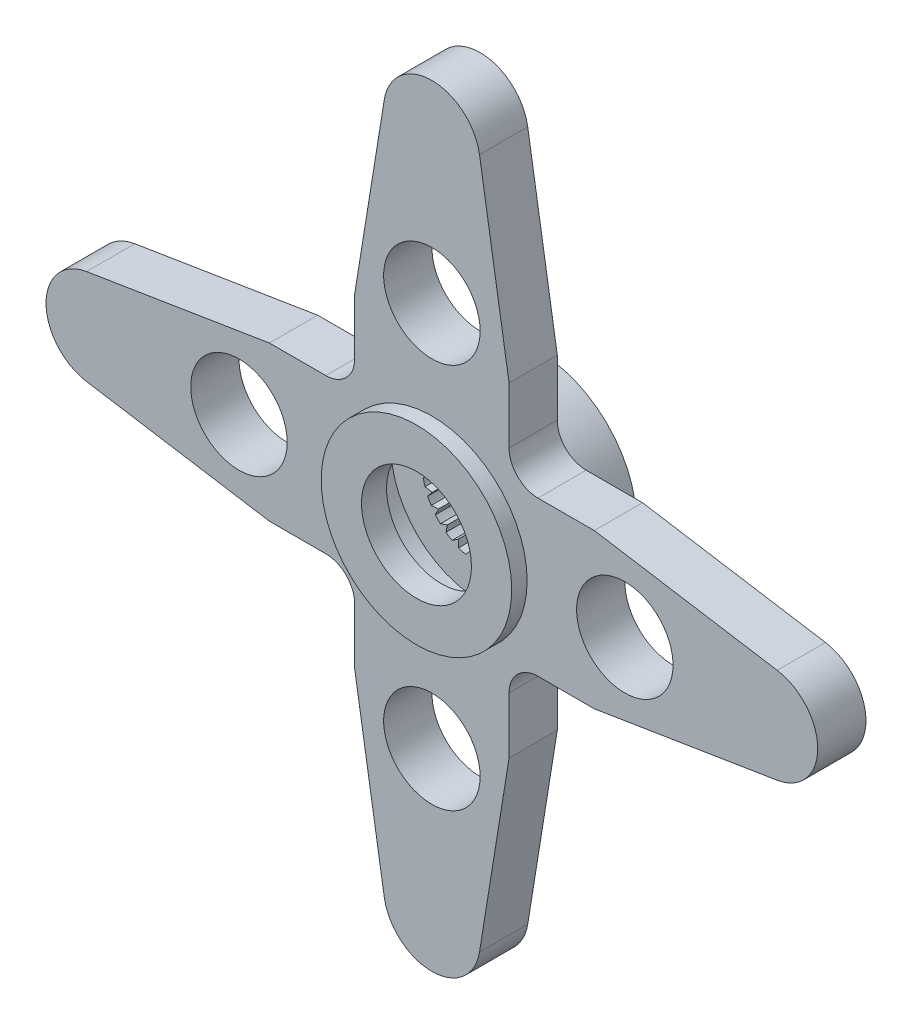
from build123d import *

# Parameters (mm, degrees)
BOSS_EXTRUDE1_DEPTH  = 2.5
M8_CLEARANCE_HOLE1_D = 9.25
SKETCH4_R            = 4.937986177
BOSS_EXTRUDE2_DEPTH  = 1.3
SKETCH5_R            = 5.099596851
BOSS_EXTRUDE3_DEPTH  = 3
CUT_EXTRUDE1_DEPTH   = 3.6
FILLET1_R            = 1.5
SKETCH11_R           = 2.5
CUT_EXTRUDE2_DEPTH   = 10


with BuildPart() as part:
    # Sketch1 → Boss-Extrude1 (new body)
    with BuildSketch(Plane.XY.offset(2.5)):
        with BuildLine():
            Line((4, -8.419183588), (4, -4))
            Line((4, -4), (8.419183588, -4))
            Line((8.419183588, -4), (17.898853189, -2.467978147))
            ThreePointArc((17.898853189, -2.467978147), (20, 0), (17.898853189, 2.467978147))
            Line((17.898853189, 2.467978147), (8.419183588, 4))
            Line((8.419183588, 4), (4, 4))
            Line((4, 4), (4, 8.419183588))
            Line((4, 8.419183588), (2.467978147, 17.898853189))
            ThreePointArc((2.467978147, 17.898853189), (0, 20), (-2.467978147, 17.898853189))
            Line((-2.467978147, 17.898853189), (-4, 8.419183588))
            Line((-4, 8.419183588), (-4, 4))
            Line((-4, 4), (-8.419183588, 4))
            Line((-8.419183588, 4), (-17.898853189, 2.467978147))
            ThreePointArc((-17.898853189, 2.467978147), (-20, 0), (-17.898853189, -2.467978147))
            Line((-17.898853189, -2.467978147), (-8.419183588, -4))
            Line((-8.419183588, -4), (-4, -4))
            Line((-4, -4), (-4, -8.419183588))
            Line((-4, -8.419183588), (-2.467978147, -17.898853189))
            ThreePointArc((-2.467978147, -17.898853189), (0, -20), (2.467978147, -17.898853189))
            Line((2.467978147, -17.898853189), (4, -8.419183588))
        make_face()
    extrude(amount=-BOSS_EXTRUDE1_DEPTH)

    # M8 Clearance Hole1 (through all)
    with Locations(Plane.XY.offset(2.5)):
        with Locations((0, 0)):
            Hole(M8_CLEARANCE_HOLE1_D / 2)

    # Sketch4 → Boss-Extrude2 (add)
    with BuildSketch(Plane(origin=(0, 0, 2), x_dir=(-1, 0, 0), z_dir=(0, 0, -1))):
        with Locations(Location((0, 0, 0), (0, 0, 180))):
            Circle(SKETCH4_R)
    extrude(amount=-BOSS_EXTRUDE2_DEPTH)

    # Sketch5 → Boss-Extrude3 (add)
    with BuildSketch(Plane.XY):
        with Locations(Location((0, 0, 0), (0, 0, 180))):
            Circle(SKETCH5_R)
    extrude(amount=-BOSS_EXTRUDE3_DEPTH)

    # Sketch6 → Cut-Extrude1 (cut)
    with BuildSketch(Plane(origin=(0, 0, -3), x_dir=(-1, 0, 0), z_dir=(0, 0, -1))):
        with BuildLine():
            Line((-2.994554723, 0.180671), (-2.667483, 0))
            Line((-2.667483, 0), (-2.993563417, -0.196413))
            ThreePointArc((-2.993563417, -0.196413), (-2.975345367, -0.383822804), (-2.94540633, -0.569720588))
            Line((-2.94540633, -0.569720588), (-2.583679116, -0.663376046))
            Line((-2.583679116, -0.663376046), (-2.850669191, -0.934711273))
            ThreePointArc((-2.850669191, -0.934711273), (-2.786416572, -1.111702609), (-2.711187226, -1.284314536))
            Line((-2.711187226, -1.284314536), (-2.337533172, -1.285069736))
            Line((-2.337533172, -1.285069736), (-2.528656935, -1.614278199))
            ThreePointArc((-2.528656935, -1.614278199), (-2.422406975, -1.76973005), (-2.306614256, -1.918210278))
            Line((-2.306614256, -1.918210278), (-1.944511421, -1.826017768))
            Line((-1.944511421, -1.826017768), (-2.047759865, -2.192414089))
            ThreePointArc((-2.047759865, -2.192414089), (-1.906188639, -2.316558843), (-1.75710823, -2.431577814))
            Line((-1.75710823, -2.431577814), (-1.429308867, -2.252230388))
            Line((-1.429308867, -2.252230388), (-1.438194511, -2.632792538))
            ThreePointArc((-1.438194511, -2.632792538), (-1.27019746, -2.717829725), (-1.097196632, -2.792160373))
            Line((-1.097196632, -2.792160373), (-0.824297579, -2.536927089))
            Line((-0.824297579, -2.536927089), (-0.738262106, -2.90774295))
            ThreePointArc((-0.738262106, -2.90774295), (-0.554395104, -2.948329369), (-0.368344134, -2.977301227))
            Line((-0.368344134, -2.977301227), (-0.167492643, -2.662219332))
            Line((-0.167492643, -2.662219332), (0.008058022, -2.999989178))
            ThreePointArc((0.008058022, -2.999989178), (0.196241936, -2.993574636), (0.383652781, -2.975367296))
            Line((0.383652781, -2.975367296), (0.499836471, -2.620234542))
            Line((0.499836471, -2.620234542), (0.753871834, -2.903735053))
            ThreePointArc((0.753871834, -2.903735053), (0.934548373, -2.850722599), (1.11154338, -2.786480094))
            Line((1.11154338, -2.786480094), (1.135759022, -2.41361078))
            Line((1.135759022, -2.41361078), (1.452317107, -2.625028575))
            ThreePointArc((1.452317107, -2.625028575), (1.614133699, -2.528749177), (1.769591621, -2.4225081))
            Line((1.769591621, -2.4225081), (1.700317656, -2.055330976))
            Line((1.700317656, -2.055330976), (2.059507955, -2.181381898))
            ThreePointArc((2.059507955, -2.181381898), (2.192297068, -2.047885144), (2.316449912, -1.906321013))
            Line((2.316449912, -1.906321013), (2.158039079, -1.567907168))
            Line((2.158039079, -1.567907168), (2.537292343, -1.600670974))
            ThreePointArc((2.537292343, -1.600670974), (2.63271035, -1.438344956), (2.717757136, -1.270352765))
            Line((2.717757136, -1.270352765), (2.48016297, -0.981965986))
            Line((2.48016297, -0.981965986), (2.855649322, -0.919384005))
            ThreePointArc((2.855649322, -0.919384005), (2.907700758, -0.738428265), (2.948297684, -0.554563582))
            Line((2.948297684, -0.554563582), (2.6464491, -0.33432427))
            Line((2.6464491, -0.33432427), (2.994575352, -0.180328758))
            ThreePointArc((2.994575352, -0.180328758), (2.999989634, 0.007886591), (2.993585845, 0.196070871))
            Line((2.993585845, 0.196070871), (2.6464491, 0.33432427))
            Line((2.6464491, 0.33432427), (2.945341199, 0.570057208))
            ThreePointArc((2.945341199, 0.570057208), (2.903778127, 0.753705902), (2.850775998, 0.93438547))
            Line((2.850775998, 0.93438547), (2.48016297, 0.981965986))
            Line((2.48016297, 0.981965986), (2.711040427, 1.284624383))
            ThreePointArc((2.711040427, 1.284624383), (2.625111562, 1.4521671), (2.528841411, 1.613989194))
            Line((2.528841411, 1.613989194), (2.158039079, 1.567907168))
            Line((2.158039079, 1.567907168), (2.306395014, 1.918473883))
            ThreePointArc((2.306395014, 1.918473883), (2.181499583, 2.059383299), (2.048010417, 2.192180041))
            Line((2.048010417, 2.192180041), (1.700317656, 2.055330976))
            Line((1.700317656, 2.055330976), (1.756830319, 2.431778614))
            ThreePointArc((1.756830319, 2.431778614), (1.600815962, 2.53720087), (1.438495397, 2.632628153))
            Line((1.438495397, 2.632628153), (1.135759022, 2.41361078))
            Line((1.135759022, 2.41361078), (1.096877515, 2.792285751))
            ThreePointArc((1.096877515, 2.792285751), (0.919547186, 2.85559678), (0.73859442, 2.907658557))
            Line((0.73859442, 2.907658557), (0.499836471, 2.620234542))
            Line((0.499836471, 2.620234542), (0.368003863, 2.977343305))
            ThreePointArc((0.368003863, 2.977343305), (0.180499879, 2.994565042), (-0.00771516, 2.999990079))
            Line((-0.00771516, 2.999990079), (-0.167492643, 2.662219332))
            Line((-0.167492643, 2.662219332), (-0.383992826, 2.975323429))
            ThreePointArc((-0.383992826, 2.975323429), (-0.569888899, 2.94537377), (-0.753539968, 2.903821192))
            Line((-0.753539968, 2.903821192), (-0.824297579, 2.536927089))
            Line((-0.824297579, 2.536927089), (-1.111861833, 2.78635304))
            ThreePointArc((-1.111861833, 2.78635304), (-1.284469462, 2.711113831), (-1.452017089, 2.62519454))
            Line((-1.452017089, 2.62519454), (-1.429308867, 2.252230388))
            Line((-1.429308867, 2.252230388), (-1.769868472, 2.422305842))
            ThreePointArc((-1.769868472, 2.422305842), (-1.918342084, 2.306504639), (-2.059258636, 2.18161726))
            Line((-2.059258636, 2.18161726), (-1.944511421, 1.826017768))
            Line((-1.944511421, 1.826017768), (-2.316667766, 1.906056259))
            ThreePointArc((-2.316667766, 1.906056259), (-2.431678218, 1.756969278), (-2.53710939, 1.600960944))
            Line((-2.53710939, 1.600960944), (-2.337533172, 1.285069736))
            Line((-2.337533172, 1.285069736), (-2.717902304, 1.270042151))
            ThreePointArc((-2.717902304, 1.270042151), (-2.792223067, 1.097037075), (-2.855544229, 0.919710365))
            Line((-2.855544229, 0.919710365), (-2.583679116, 0.663376046))
            Line((-2.583679116, 0.663376046), (-2.948361045, 0.554226624))
            ThreePointArc((-2.948361045, 0.554226624), (-2.977322271, 0.368173999), (-2.994554723, 0.180671))
        make_face()
    extrude(amount=-CUT_EXTRUDE1_DEPTH, mode=Mode.SUBTRACT)

    # Sketch9 → CBORE for M2.5 Hex Head Machine Screw1 (revolve, cut)
    with BuildSketch(Plane(origin=(0, 0, 3.3), x_dir=(0, -1, 0), z_dir=(1, 0, 0))):
        Polygon((0, 0), (0, 1.3), (1.5, 1.3), (1.5, 1.5), (2.85, 1.5), (2.85, 0), align=None)
    revolve(axis=Axis((0, 0, 9.65), (0, 0, -1)), mode=Mode.SUBTRACT)

    # Fillet1
    fillet1_edges = [part.edges().sort_by_distance(p)[0] for p in [
        (-4, -4, 1.25),
        (-4, 4, 1.25),
        (4, 4, 1.25),
        (4, -4, 1.25),
    ]]
    fillet(fillet1_edges, radius=FILLET1_R)

    # Sketch11 → Cut-Extrude2 (cut)
    with BuildSketch(Plane.XY.offset(2.5)):
        with Locations((-10, 0)):
            Circle(SKETCH11_R)
        with Locations((10, 0)):
            Circle(SKETCH11_R)
        with Locations((0, -10)):
            Circle(SKETCH11_R)
        with Locations((0, 10)):
            Circle(SKETCH11_R)
    extrude(amount=-CUT_EXTRUDE2_DEPTH, mode=Mode.SUBTRACT)


solid = part.part
